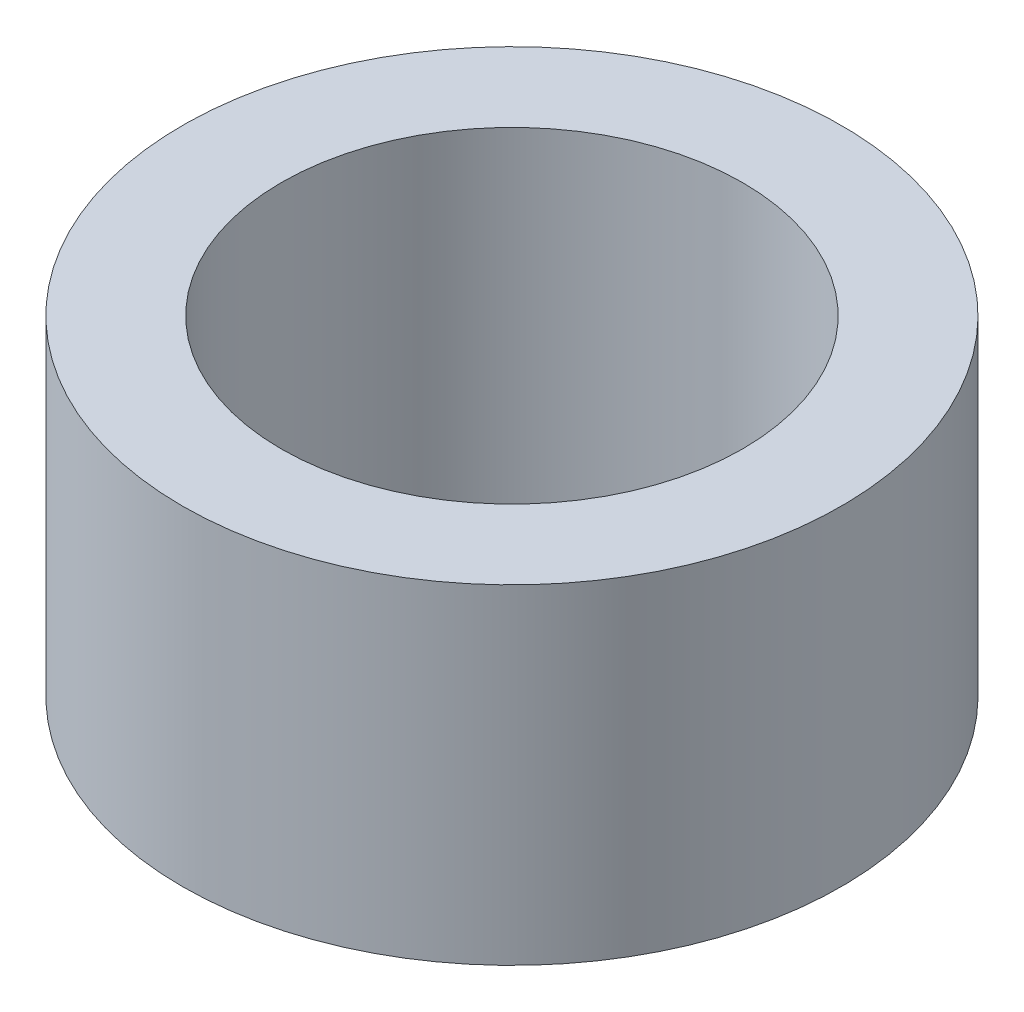
from build123d import *

# Parameters (mm, degrees)
SKETCH_1_R      = 3
SKETCH_1_R_2    = 2.1
EXTRUDE_1_DEPTH = 3


with BuildPart() as part:
    # ｽｹｯﾁ1 → ﾎﾞｽ - 押し出し1 (new body)
    with BuildSketch(Plane(origin=(0, 0, 0), x_dir=(1, 0, 0), z_dir=(0, 1, 0))):
        with Locations(Location((0, 0, 0), (0, 0, 270))):
            Circle(SKETCH_1_R)
        with Locations(Location((0, 0, 0), (0, 0, 270))):
            Circle(SKETCH_1_R_2, mode=Mode.SUBTRACT)
    extrude(amount=EXTRUDE_1_DEPTH)


solid = part.part
